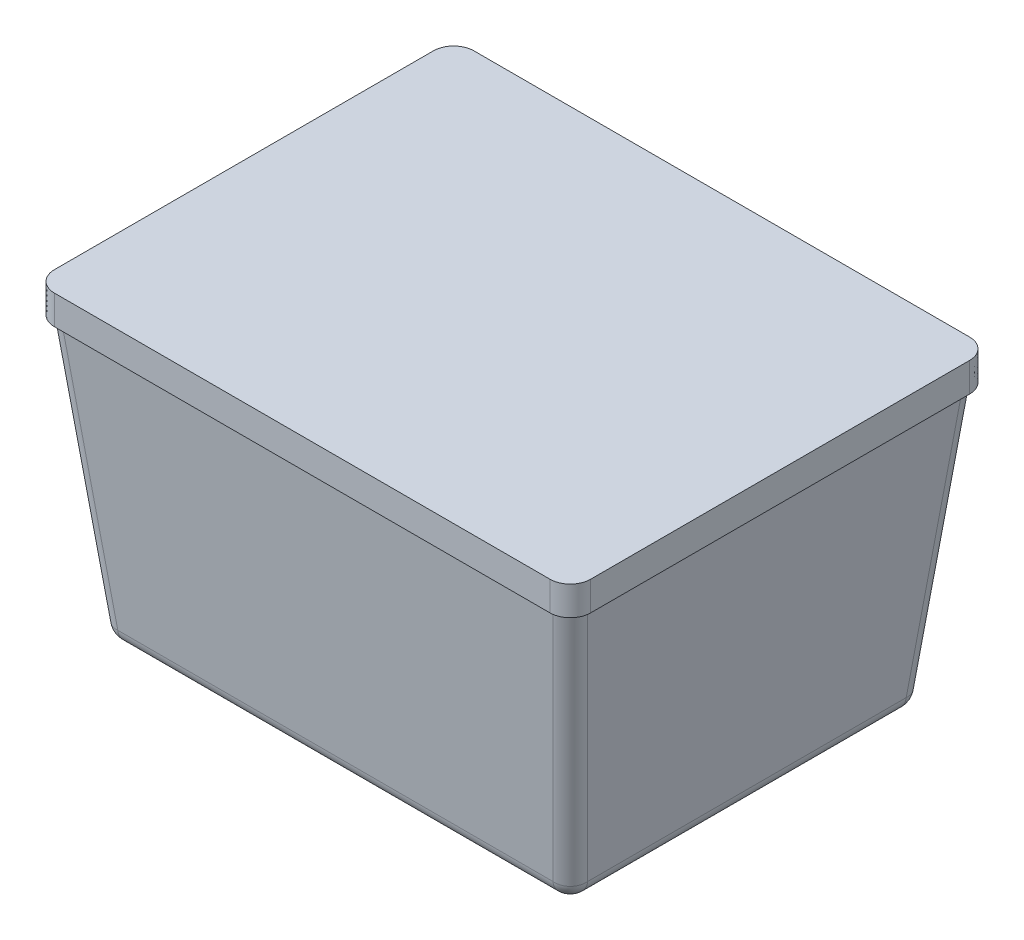
from build123d import *

# Parameters (mm, degrees)
CROQUIS1_W     = 800
CROQUIS1_H     = 600
EXTRUIR1_DEPTH = 520
EXTRUIR1_DRAFT = -6
REDONDEO1_R    = 30
VACIADO1_T     = -10
EXTRUIR2_DEPTH = 40
EXTRUIR3_DEPTH = 10


with BuildPart() as part:
    # Croquis1 → Extruir1 (with draft: the straight prism first)
    with BuildSketch(Plane(origin=(0, 0, 0), x_dir=(1, 0, 0), z_dir=(0, 1, 0))):
        Rectangle(CROQUIS1_W, CROQUIS1_H)
    extrude(amount=EXTRUIR1_DEPTH)
    # Extruir1: the draft: its side faces are tilted about the plane it starts from
    extruir1_sides = [part.faces().sort_by_distance(p)[0] for p in [
        (400, 260, 0),
        (0, 260, -300),
        (-400, 260, 0),
        (0, 260, 300),
    ]]
    draft(extruir1_sides, Plane(origin=(0, 0, 0), x_dir=(1, 0, 0), z_dir=(0, 1, 0)), EXTRUIR1_DRAFT)

    # Redondeo1
    redondeo1_edges = [part.edges().sort_by_distance(p)[0] for p in [
        (0, 0, -300),
        (400, 0, 0),
        (0, 0, 300),
        (-400, 0, 0),
        (-427.327101169, 260, -327.327101169),
        (427.327101169, 260, -327.327101169),
        (427.327101169, 260, 327.327101169),
        (-427.327101169, 260, 327.327101169),
    ]]
    fillet(redondeo1_edges, radius=REDONDEO1_R)

    # Vaciado1
    vaciado1_openings = [part.faces().sort_by_distance(p)[0] for p in [
        (0, 520, 0),
    ]]
    offset(amount=VACIADO1_T, openings=vaciado1_openings, kind=Kind.INTERSECTION)


with BuildPart() as body_2:
    # Croquis2 → Extruir2 (new body)
    with BuildSketch(Plane(origin=(0, 520, 0), x_dir=(1, 0, 0), z_dir=(0, 1, 0))):
        with BuildLine():
            Line((424.818545477, 359.654202338), (-424.818545477, 359.654202338))
            add(Edge.make_bspline(
                [(-424.818545477, 359.654202338), (-427.120086028, 359.654202338), (-429.380934681, 359.430411757), (-432.713747218, 358.773214804), (-433.814869933, 358.500171352), (-435.451518922, 358.007918705), (-435.994558337, 357.830029047), (-437.075507941, 357.446040848), (-437.613820315, 357.239674494), (-440.2615232, 356.148907719), (-442.265343116, 355.081190983), (-445.10317609, 353.193132085), (-446.020940364, 352.51569528), (-447.353923908, 351.425037779), (-447.790551127, 351.049250723), (-448.639460703, 350.281234378), (-449.053000136, 349.888002267), (-451.066995309, 347.87646125), (-452.507863424, 346.123294027), (-454.41183532, 343.276088185), (-455.005828534, 342.285067005), (-456.083159903, 340.267175368), (-456.568789235, 339.23798924), (-457.870403065, 336.091173443), (-458.532675254, 333.914517133), (-459.430368248, 329.399769105), (-459.654202338, 327.120197811), (-459.654202338, 324.818545477)],
                knots=[0, 0, 0, 0, 0.125, 0.125, 0.1875, 0.1875, 0.21875, 0.21875, 0.25, 0.25, 0.375, 0.375, 0.4375, 0.4375, 0.46875, 0.46875, 0.5, 0.5, 0.625, 0.625, 0.6875, 0.6875, 0.75, 0.75, 0.875, 0.875, 1, 1, 1, 1], degree=3))
            Line((-459.654202338, 324.818545477), (-459.654202338, -324.818545477))
            add(Edge.make_bspline(
                [(-459.654202338, -324.818545477), (-459.654202338, -327.120086028), (-459.430411757, -329.380934681), (-458.773214804, -332.713747218), (-458.500171352, -333.814869933), (-458.007918705, -335.451518922), (-457.830029047, -335.994558337), (-457.446040848, -337.075507941), (-457.239674494, -337.613820315), (-456.148907719, -340.2615232), (-455.081190983, -342.265343116), (-453.193132085, -345.10317609), (-452.51569528, -346.020940364), (-451.425037779, -347.353923908), (-451.049250723, -347.790551127), (-450.281234378, -348.639460703), (-449.888002267, -349.053000136), (-447.87646125, -351.066995309), (-446.123294027, -352.507863424), (-443.276088185, -354.41183532), (-442.285067005, -355.005828534), (-440.267175368, -356.083159903), (-439.23798924, -356.568789235), (-436.091173443, -357.870403065), (-433.914517133, -358.532675254), (-429.399769105, -359.430368248), (-427.120197811, -359.654202338), (-424.818545477, -359.654202338)],
                knots=[0, 0, 0, 0, 0.125, 0.125, 0.1875, 0.1875, 0.21875, 0.21875, 0.25, 0.25, 0.375, 0.375, 0.4375, 0.4375, 0.46875, 0.46875, 0.5, 0.5, 0.625, 0.625, 0.6875, 0.6875, 0.75, 0.75, 0.875, 0.875, 1, 1, 1, 1], degree=3))
            Line((-424.818545477, -359.654202338), (424.818545477, -359.654202338))
            add(Edge.make_bspline(
                [(424.818545477, -359.654202338), (427.120086028, -359.654202338), (429.380934681, -359.430411757), (432.713747218, -358.773214804), (433.814869933, -358.500171352), (435.451518922, -358.007918705), (435.994558337, -357.830029047), (437.075507941, -357.446040848), (437.613820315, -357.239674494), (440.2615232, -356.148907719), (442.265343116, -355.081190983), (445.10317609, -353.193132085), (446.020940364, -352.51569528), (447.353923908, -351.425037779), (447.790551127, -351.049250723), (448.639460703, -350.281234378), (449.053000136, -349.888002267), (451.066995309, -347.87646125), (452.507863424, -346.123294027), (454.41183532, -343.276088185), (455.005828534, -342.285067005), (456.083159903, -340.267175368), (456.568789235, -339.23798924), (457.870403065, -336.091173443), (458.532675254, -333.914517133), (459.430368248, -329.399769105), (459.654202338, -327.120197811), (459.654202338, -324.818545477)],
                knots=[0, 0, 0, 0, 0.125, 0.125, 0.1875, 0.1875, 0.21875, 0.21875, 0.25, 0.25, 0.375, 0.375, 0.4375, 0.4375, 0.46875, 0.46875, 0.5, 0.5, 0.625, 0.625, 0.6875, 0.6875, 0.75, 0.75, 0.875, 0.875, 1, 1, 1, 1], degree=3))
            Line((459.654202338, -324.818545477), (459.654202338, 324.818545477))
            add(Edge.make_bspline(
                [(459.654202338, 324.818545477), (459.654202338, 327.120086028), (459.430411757, 329.380934681), (458.773214804, 332.713747218), (458.500171352, 333.814869933), (458.007918705, 335.451518922), (457.830029047, 335.994558337), (457.446040848, 337.075507941), (457.239674494, 337.613820315), (456.148907719, 340.2615232), (455.081190983, 342.265343116), (453.193132085, 345.10317609), (452.51569528, 346.020940364), (451.425037779, 347.353923908), (451.049250723, 347.790551127), (450.281234378, 348.639460703), (449.888002267, 349.053000136), (447.87646125, 351.066995309), (446.123294027, 352.507863424), (443.276088185, 354.41183532), (442.285067005, 355.005828534), (440.267175368, 356.083159903), (439.23798924, 356.568789235), (436.091173443, 357.870403065), (433.914517133, 358.532675254), (429.399769105, 359.430368248), (427.120197811, 359.654202338), (424.818545477, 359.654202338)],
                knots=[0, 0, 0, 0, 0.125, 0.125, 0.1875, 0.1875, 0.21875, 0.21875, 0.25, 0.25, 0.375, 0.375, 0.4375, 0.4375, 0.46875, 0.46875, 0.5, 0.5, 0.625, 0.625, 0.6875, 0.6875, 0.75, 0.75, 0.875, 0.875, 1, 1, 1, 1], degree=3))
        make_face()
    extrude(amount=-EXTRUIR2_DEPTH)

    # Croquis3 → Extruir3 (add)
    with BuildSketch(Plane(origin=(0, 520, 0), x_dir=(1, 0, 0), z_dir=(0, 1, 0))):
        with BuildLine():
            Line((-459.654202338, 324.818545477), (-459.654202338, -324.818545477))
            add(Edge.make_bspline(
                [(-459.654202338, -324.818545477), (-459.654202338, -327.120086028), (-459.430411757, -329.380934681), (-458.773214804, -332.713747218), (-458.500171352, -333.814869933), (-458.007918705, -335.451518922), (-457.830029047, -335.994558337), (-457.446040848, -337.075507941), (-457.239674494, -337.613820315), (-456.148907719, -340.2615232), (-455.081190983, -342.265343116), (-453.193132085, -345.10317609), (-452.51569528, -346.020940364), (-451.425037779, -347.353923908), (-451.049250723, -347.790551127), (-450.281234378, -348.639460703), (-449.888002267, -349.053000136), (-447.87646125, -351.066995309), (-446.123294027, -352.507863424), (-443.276088185, -354.41183532), (-442.285067005, -355.005828534), (-440.267175368, -356.083159903), (-439.23798924, -356.568789235), (-436.091173443, -357.870403065), (-433.914517133, -358.532675254), (-429.399769105, -359.430368248), (-427.120197811, -359.654202338), (-424.818545477, -359.654202338)],
                knots=[0, 0, 0, 0, 0.125, 0.125, 0.1875, 0.1875, 0.21875, 0.21875, 0.25, 0.25, 0.375, 0.375, 0.4375, 0.4375, 0.46875, 0.46875, 0.5, 0.5, 0.625, 0.625, 0.6875, 0.6875, 0.75, 0.75, 0.875, 0.875, 1, 1, 1, 1], degree=3))
            Line((-424.818545477, -359.654202338), (424.818545477, -359.654202338))
            add(Edge.make_bspline(
                [(424.818545477, -359.654202338), (427.120086028, -359.654202338), (429.380934681, -359.430411757), (432.713747218, -358.773214804), (433.814869933, -358.500171352), (435.451518922, -358.007918705), (435.994558337, -357.830029047), (437.075507941, -357.446040848), (437.613820315, -357.239674494), (440.2615232, -356.148907719), (442.265343116, -355.081190983), (445.10317609, -353.193132085), (446.020940364, -352.51569528), (447.353923908, -351.425037779), (447.790551127, -351.049250723), (448.639460703, -350.281234378), (449.053000136, -349.888002267), (451.066995309, -347.87646125), (452.507863424, -346.123294027), (454.41183532, -343.276088185), (455.005828534, -342.285067005), (456.083159903, -340.267175368), (456.568789235, -339.23798924), (457.870403065, -336.091173443), (458.532675254, -333.914517133), (459.430368248, -329.399769105), (459.654202338, -327.120197811), (459.654202338, -324.818545477)],
                knots=[0, 0, 0, 0, 0.125, 0.125, 0.1875, 0.1875, 0.21875, 0.21875, 0.25, 0.25, 0.375, 0.375, 0.4375, 0.4375, 0.46875, 0.46875, 0.5, 0.5, 0.625, 0.625, 0.6875, 0.6875, 0.75, 0.75, 0.875, 0.875, 1, 1, 1, 1], degree=3))
            Line((459.654202338, -324.818545477), (459.654202338, 324.818545477))
            add(Edge.make_bspline(
                [(459.654202338, 324.818545477), (459.654202338, 327.120086028), (459.430411757, 329.380934681), (458.773214804, 332.713747218), (458.500171352, 333.814869933), (458.007918705, 335.451518922), (457.830029047, 335.994558337), (457.446040848, 337.075507941), (457.239674494, 337.613820315), (456.148907719, 340.2615232), (455.081190983, 342.265343116), (453.193132085, 345.10317609), (452.51569528, 346.020940364), (451.425037779, 347.353923908), (451.049250723, 347.790551127), (450.281234378, 348.639460703), (449.888002267, 349.053000136), (447.87646125, 351.066995309), (446.123294027, 352.507863424), (443.276088185, 354.41183532), (442.285067005, 355.005828534), (440.267175368, 356.083159903), (439.23798924, 356.568789235), (436.091173443, 357.870403065), (433.914517133, 358.532675254), (429.399769105, 359.430368248), (427.120197811, 359.654202338), (424.818545477, 359.654202338)],
                knots=[0, 0, 0, 0, 0.125, 0.125, 0.1875, 0.1875, 0.21875, 0.21875, 0.25, 0.25, 0.375, 0.375, 0.4375, 0.4375, 0.46875, 0.46875, 0.5, 0.5, 0.625, 0.625, 0.6875, 0.6875, 0.75, 0.75, 0.875, 0.875, 1, 1, 1, 1], degree=3))
            Line((424.818545477, 359.654202338), (-424.818545477, 359.654202338))
            add(Edge.make_bspline(
                [(-424.818545477, 359.654202338), (-427.120086028, 359.654202338), (-429.380934681, 359.430411757), (-432.713747218, 358.773214804), (-433.814869933, 358.500171352), (-435.451518922, 358.007918705), (-435.994558337, 357.830029047), (-437.075507941, 357.446040848), (-437.613820315, 357.239674494), (-440.2615232, 356.148907719), (-442.265343116, 355.081190983), (-445.10317609, 353.193132085), (-446.020940364, 352.51569528), (-447.353923908, 351.425037779), (-447.790551127, 351.049250723), (-448.639460703, 350.281234378), (-449.053000136, 349.888002267), (-451.066995309, 347.87646125), (-452.507863424, 346.123294027), (-454.41183532, 343.276088185), (-455.005828534, 342.285067005), (-456.083159903, 340.267175368), (-456.568789235, 339.23798924), (-457.870403065, 336.091173443), (-458.532675254, 333.914517133), (-459.430368248, 329.399769105), (-459.654202338, 327.120197811), (-459.654202338, 324.818545477)],
                knots=[0, 0, 0, 0, 0.125, 0.125, 0.1875, 0.1875, 0.21875, 0.21875, 0.25, 0.25, 0.375, 0.375, 0.4375, 0.4375, 0.46875, 0.46875, 0.5, 0.5, 0.625, 0.625, 0.6875, 0.6875, 0.75, 0.75, 0.875, 0.875, 1, 1, 1, 1], degree=3))
        make_face()
    extrude(amount=EXTRUIR3_DEPTH)


solid = Compound([part.part, body_2.part])
